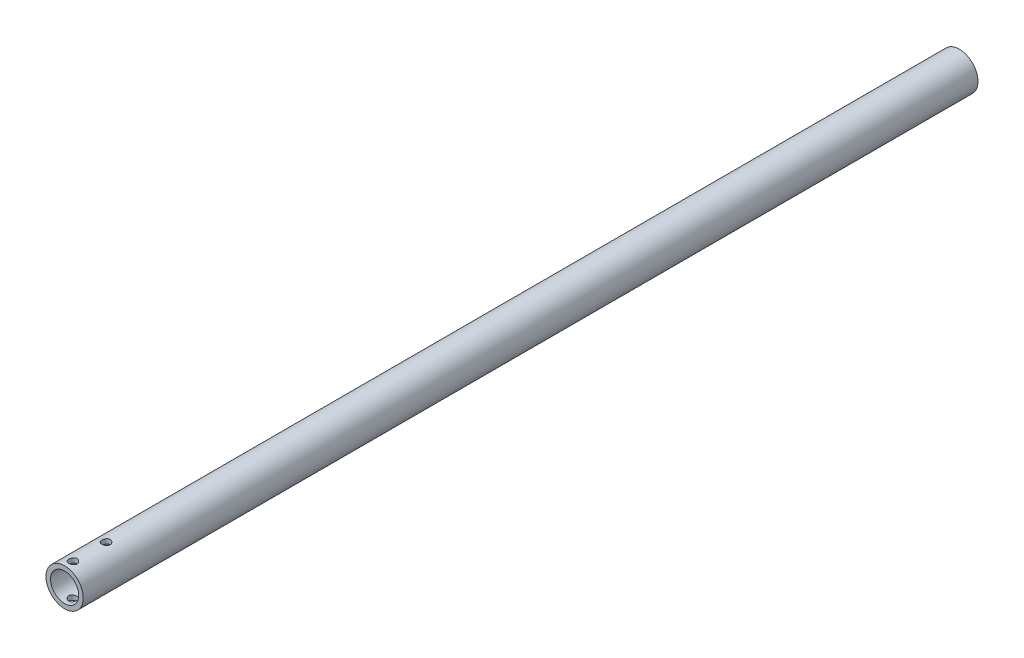
from build123d import *

# Parameters (mm, degrees)
SKETCH1_R                            = 14.2875
SKETCH1_R_2                          = 9.525
BOSS_EXTRUDE1_DEPTH                  = 685.8
CUT_EXTRUDE1_DEPTH                   = 687.097591682
CUT_EXTRUDE2_START                   = -38.1
SKETCH3_R                            = 10.795
SKETCH3_R_2                          = 9.525
CUT_EXTRUDE2_DEPTH                   = 38.1
CUT_EXTRUDE3_DEPTH                   = 687.097591787
SKETCH7_W                            = 3.175
SKETCH7_H                            = 14.2875
F_1_4_0_25_DIAMETER_HOLE1_AT_2_COUNT = 2
F_1_4_0_25_DIAMETER_HOLE1_AT_2_PITCH = 25.4
CIRPATTERN1_COUNT                    = 2
CIRPATTERN1_COPY_1_SKETCH_W          = 3.175
CIRPATTERN1_COPY_1_SKETCH_H          = 14.2875


with BuildPart() as part:
    # Sketch1 → Boss-Extrude1 (new body)
    with BuildSketch(Plane.XY):
        Circle(SKETCH1_R)
        Circle(SKETCH1_R_2, mode=Mode.SUBTRACT)
    extrude(amount=BOSS_EXTRUDE1_DEPTH)

    # Sketch2 → Cut-Extrude1 (cut, through all)
    with BuildSketch(Plane(origin=(0, 0, 0), x_dir=(1, 0, 0), z_dir=(0, 1, 0))):
        with BuildLine():
            Line((7.9375, -127), (7.9375, -203.2))
            ThreePointArc((7.9375, -203.2), (0, -211.1375), (-7.9375, -203.2))
            Line((-7.9375, -203.2), (-7.9375, -127))
            ThreePointArc((-7.9375, -127), (0, -119.0625), (7.9375, -127))
        make_face()
    extrude(amount=-CUT_EXTRUDE1_DEPTH, mode=Mode.SUBTRACT)

    # Sketch3 → Cut-Extrude2 (cut)
    with BuildSketch(Plane.XY.offset(685.8).offset(CUT_EXTRUDE2_START)):
        Circle(SKETCH3_R)
        Circle(SKETCH3_R_2, mode=Mode.SUBTRACT)
    extrude(amount=CUT_EXTRUDE2_DEPTH, mode=Mode.SUBTRACT)

    # Sketch4 → Cut-Extrude3 (cut, through all)
    with BuildSketch(Plane(origin=(0, 0, 0), x_dir=(1, 0, 0), z_dir=(0, 1, 0))):
        with BuildLine():
            Line((-8.001, -635), (-8.001, -596.9))
            ThreePointArc((-8.001, -596.9), (0, -588.899), (8.001, -596.9))
            Line((8.001, -596.9), (8.001, -635))
            ThreePointArc((8.001, -635), (0, -643.001), (-8.001, -635))
        make_face()
    extrude(amount=-CUT_EXTRUDE3_DEPTH, mode=Mode.SUBTRACT)

    # Sketch7 → 1/4 (0.25) Diameter Hole1 (revolve, cut)
    with BuildSketch(Plane(origin=(0, 0, 654.05), x_dir=(0, 0, -1), z_dir=(1, 0, 0))):
        with Locations((1.5875, 7.14375)):
            Rectangle(SKETCH7_W, SKETCH7_H)
    f_1_4_0_25_diameter_hole1 = revolve(axis=Axis((0, -6.35, 654.05), (0, 1, 0)), mode=Mode.SUBTRACT)

    # 1/4 (0.25) Diameter Hole1 at 2: 1/4 (0.25) Diameter Hole1 ×2
    with Locations(*[(0, 0, i * F_1_4_0_25_DIAMETER_HOLE1_AT_2_PITCH) for i in range(1, F_1_4_0_25_DIAMETER_HOLE1_AT_2_COUNT)]):
        add(f_1_4_0_25_diameter_hole1, mode=Mode.SUBTRACT)

    # CirPattern1: 1/4 (0.25) Diameter Hole1 ×2 about axis
    cirpattern1_axis = Axis((0, 0, 647.7), (0, 0, 1))
    for i in range(1, CIRPATTERN1_COUNT):
        add(f_1_4_0_25_diameter_hole1.rotate(cirpattern1_axis, i * 360 / CIRPATTERN1_COUNT), mode=Mode.SUBTRACT)

    # CirPattern1 copy 1 sketch → CirPattern1 copy 1 (revolve, cut)
    with BuildSketch(Plane(origin=(0, 0, 679.45), x_dir=(0, 0, -1), z_dir=(-1, 0, 0))):
        with Locations((1.5875, 7.14375)):
            Rectangle(CIRPATTERN1_COPY_1_SKETCH_W, CIRPATTERN1_COPY_1_SKETCH_H)
    revolve(axis=Axis((0, 6.35, 679.45), (0, -1, 0)), mode=Mode.SUBTRACT)


solid = part.part
